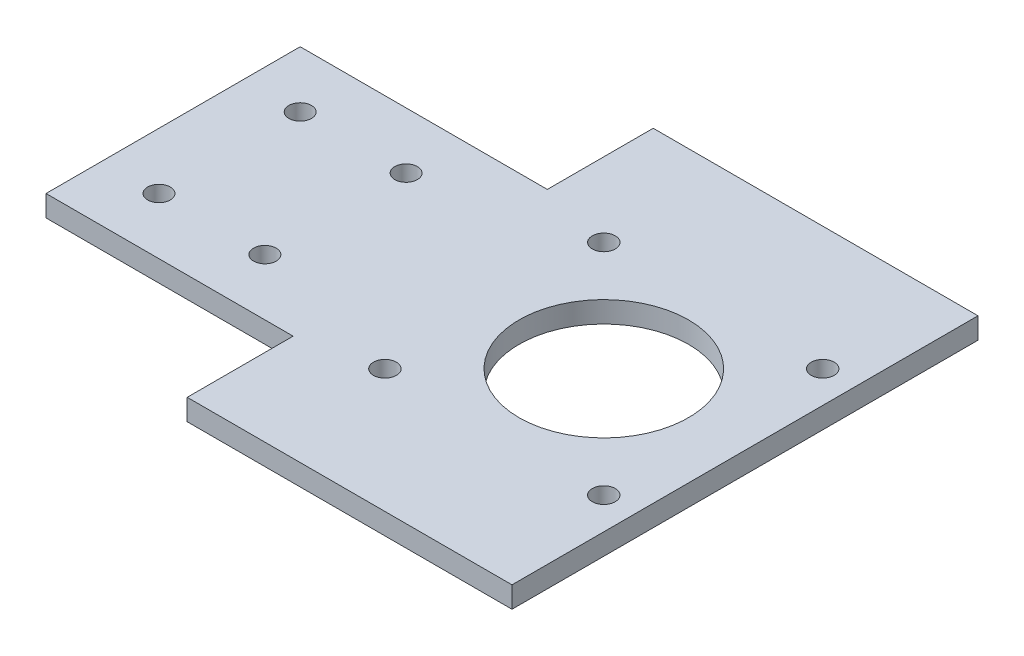
from build123d import *

# Parameters (mm, degrees)
EXTRUDE_1_DEPTH     = 3
SKETCH_2_R          = 1.6
SKETCH_2_R_2        = 12
CUT_EXTRUDE_1_DEPTH = 3
SKETCH_4_R          = 1.625
CUT_EXTRUDE_2_DEPTH = 96.765338197


with BuildPart() as part:
    # 草图1 → 凸台-拉伸1 (new body)
    with BuildSketch(Plane(origin=(0, 0, 0), x_dir=(1, 0, 0), z_dir=(0, 1, 0))):
        Polygon((0, 0), (0, 36), (35, 36), (35, 51), (81, 51), (81, -15), (35, -15), (35, 0), align=None)
    extrude(amount=EXTRUDE_1_DEPTH)

    # 草图2 → 切除-拉伸1 (cut)
    with BuildSketch(Plane(origin=(0, 3, 0), x_dir=(1, 0, 0), z_dir=(0, 1, 0))):
        with Locations(Location((8, 28, 0), (0, 0, 270))):
            Circle(SKETCH_2_R)
        with Locations(Location((23, 28, 0), (0, 0, 270))):
            Circle(SKETCH_2_R)
        with Locations(Location((8, 8, 0), (0, 0, 270))):
            Circle(SKETCH_2_R)
        with Locations(Location((23, 8, 0), (0, 0, 270))):
            Circle(SKETCH_2_R)
        with Locations(Location((61, 18, 0), (0, 0, 270))):
            Circle(SKETCH_2_R_2)
    extrude(amount=-CUT_EXTRUDE_1_DEPTH, mode=Mode.SUBTRACT)

    # 草图4 → 切除-拉伸2 (cut, through all)
    with BuildSketch(Plane.XZ):
        with Locations(Location((45.5, -33.5, 0), (0, 0, 270))):
            Circle(SKETCH_4_R)
        with Locations(Location((76.5, -33.5, 0), (0, 0, 270))):
            Circle(SKETCH_4_R)
        with Locations(Location((76.5, -2.5, 0), (0, 0, 270))):
            Circle(SKETCH_4_R)
        with Locations(Location((45.5, -2.5, 0), (0, 0, 270))):
            Circle(SKETCH_4_R)
    extrude(amount=-CUT_EXTRUDE_2_DEPTH, mode=Mode.SUBTRACT)


solid = part.part
